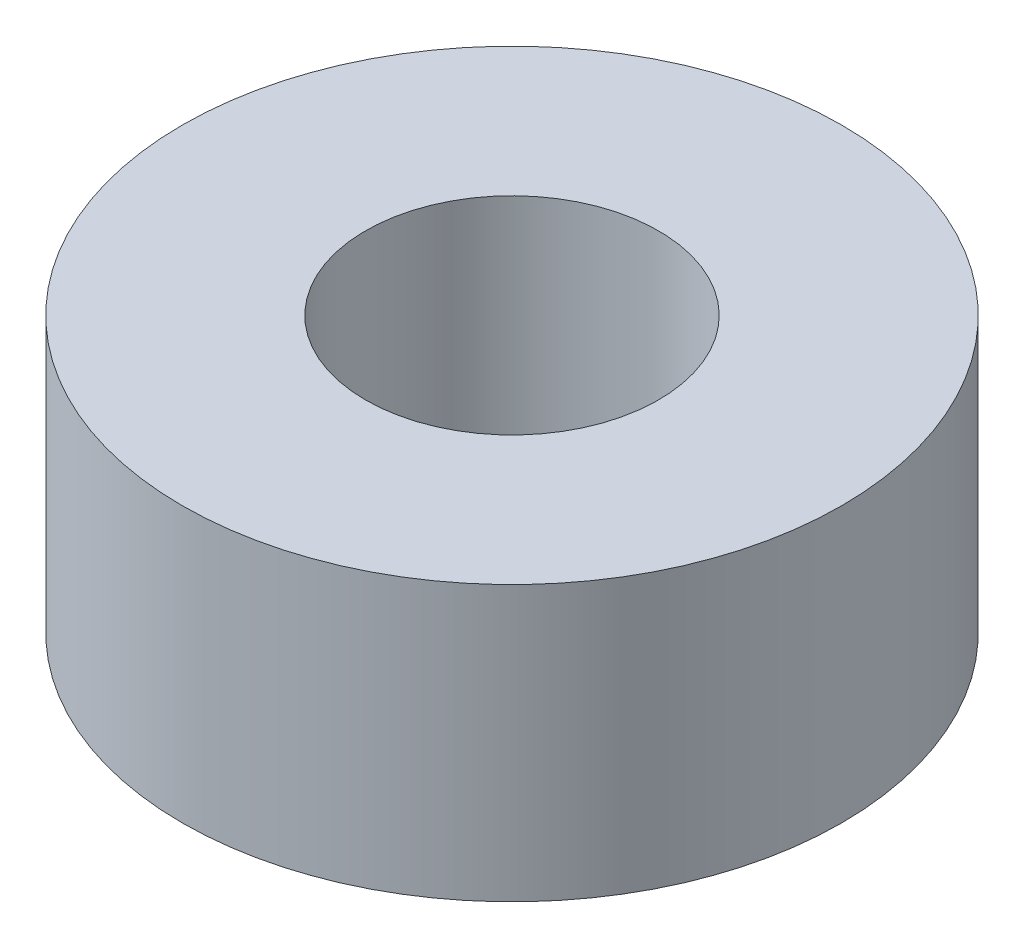
from build123d import *

# Parameters (mm, degrees)
ESBO_O1_R                = 3.6
ESBO_O1_R_2              = 1.6
RESSALTO_EXTRUS_O1_DEPTH = 3


with BuildPart() as part:
    # Esboço1 → Ressalto-extrusão1 (new body)
    with BuildSketch(Plane(origin=(0, 0, 0), x_dir=(1, 0, 0), z_dir=(0, 1, 0))):
        with Locations(Location((0, 0, 0), (0, 0, 270))):
            Circle(ESBO_O1_R)
        with Locations(Location((0, 0, 0), (0, 0, 270))):
            Circle(ESBO_O1_R_2, mode=Mode.SUBTRACT)
    extrude(amount=RESSALTO_EXTRUS_O1_DEPTH)


solid = part.part
